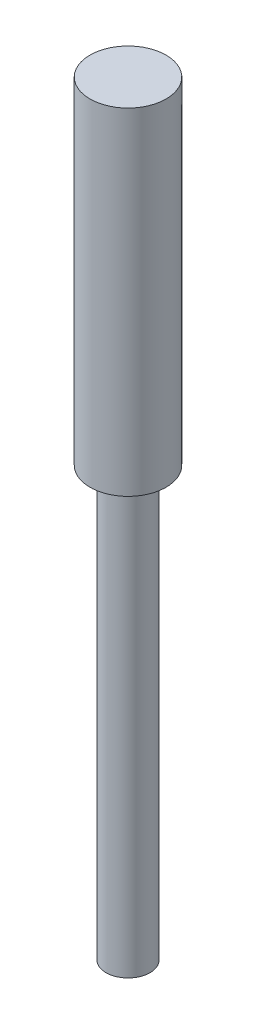
from build123d import *


with BuildPart() as part:
    # Sketch1 → Revolve1 (revolve)
    with BuildSketch(Plane.XY, mode=Mode.PRIVATE) as revolve1_sk:
        Polygon((0, 0), (1.375, 0), (1.375, 26.75), (2.375, 26.75), (2.375, 47.75), (0, 47.75), align=None)
    revolve(revolve1_sk.sketch.rotate(Axis((0, 0, 0), (0, 1, 0)), 90), axis=Axis((0, 0, 0), (0, 1, 0)))


solid = part.part
